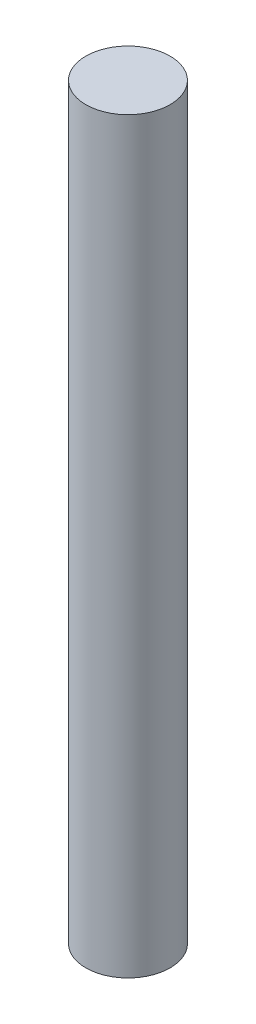
from build123d import *

# Parameters (mm, degrees)
SKETCH1_R           = 37.465
BOSS_EXTRUDE1_DEPTH = 665.48


with BuildPart() as part:
    # Sketch1 → Boss-Extrude1 (new body)
    with BuildSketch(Plane(origin=(0, 0, 0), x_dir=(1, 0, 0), z_dir=(0, 1, 0))):
        with Locations(Location((0, 0, 0), (0, 0, 270))):
            Circle(SKETCH1_R)
    extrude(amount=BOSS_EXTRUDE1_DEPTH)


solid = part.part
